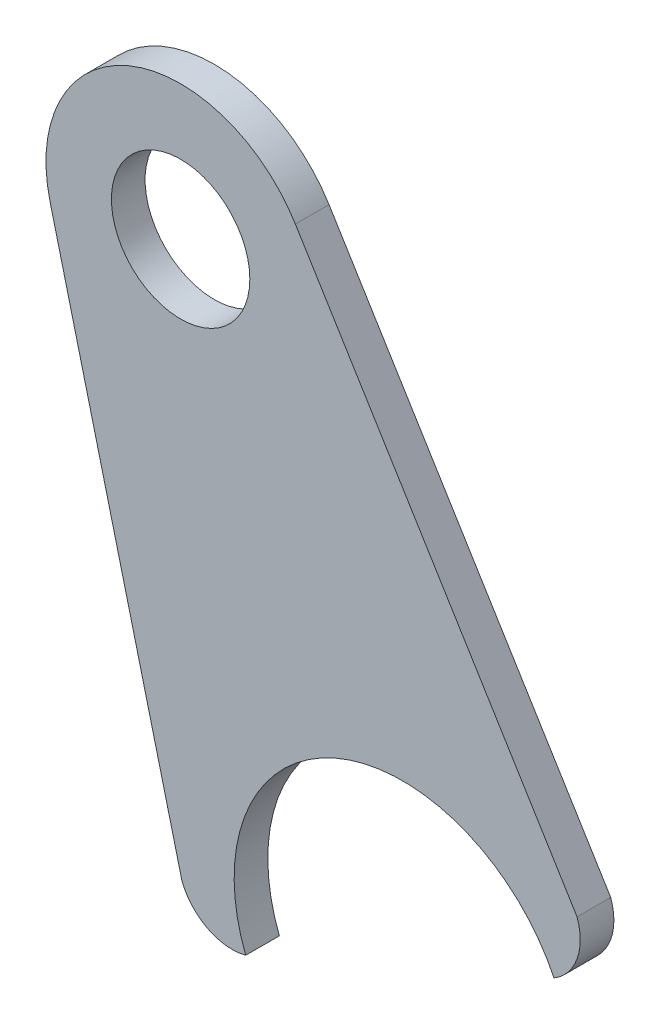
from build123d import *

# Parameters (mm, degrees)
SKETCH1_R           = 3.2639
BOSS_EXTRUDE1_DEPTH = 1.5875


with BuildPart() as part:
    # Sketch1 → Boss-Extrude1 (new body)
    with BuildSketch(Plane.XY):
        with BuildLine():
            Line((-10.399223057, -1.355304965), (-16.618892138, 23.271422721))
            ThreePointArc((-16.618892138, 23.271422721), (-12.928176814, 30.677964445), (-5.049599818, 28.146904502))
            Line((-5.049599818, 28.146904502), (8.232658224, 6.496462906))
            ThreePointArc((8.232658224, 6.496462906), (8.235912134, 4.780099916), (7.146821009, 3.45352801))
            ThreePointArc((7.146821009, 3.45352801), (-3.173435189, 7.275521655), (-7.393250126, -2.888556529))
            ThreePointArc((-7.393250126, -2.888556529), (-9.187644243, -2.693241765), (-10.399223057, -1.355304965))
        make_face()
        with Locations((-10.462210217, 24.826339992)):
            Circle(SKETCH1_R, mode=Mode.SUBTRACT)
    extrude(amount=BOSS_EXTRUDE1_DEPTH)


solid = part.part
